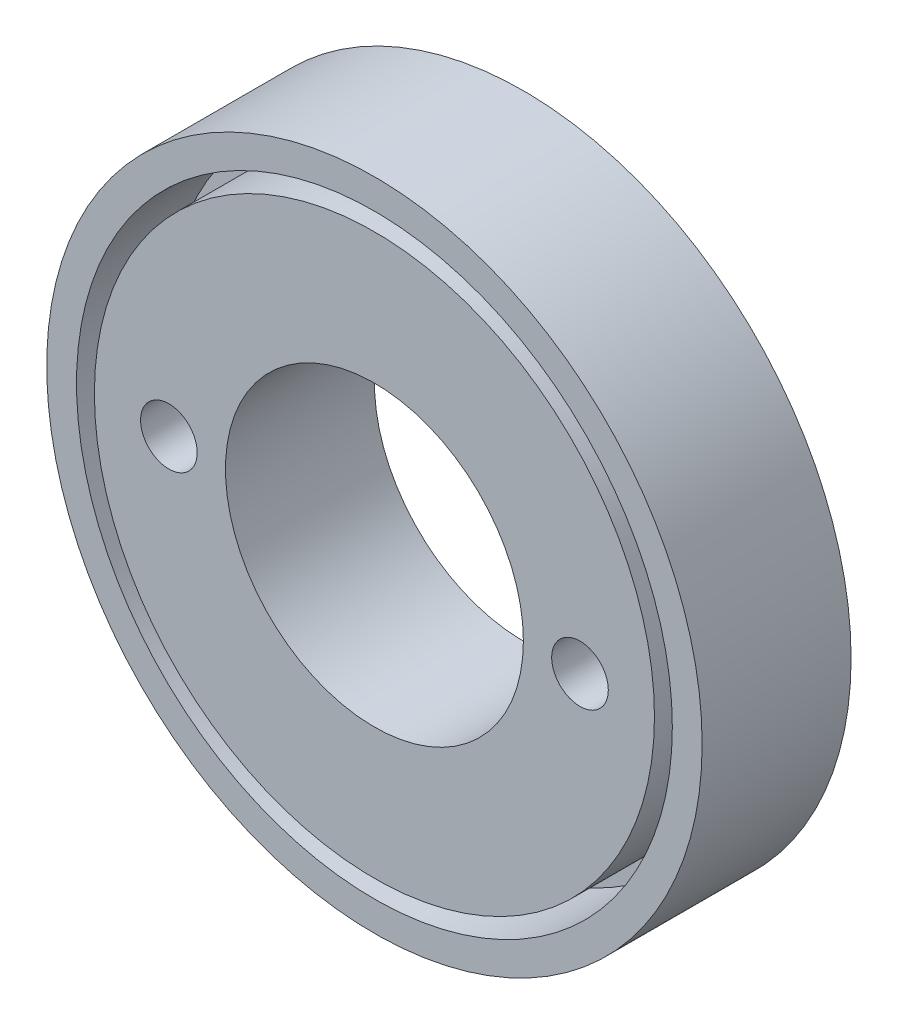
from build123d import *

# Parameters (mm, degrees)
BOSS_EXTRUDE1_DEPTH      = 10
BOSS_EXTRUDE1_DEPTH_BACK = 15
SKETCH1_R                = 55
SKETCH1_R_2              = 25
SKETCH2_R                = 50
SKETCH2_R_2              = 47
SKETCH2_R_3              = 4.75
CUT_EXTRUDE1_DEPTH       = 15


with BuildPart() as part:
    # Sketch1 → Boss-Extrude1 (new, two sides: drawn at the far end of the back side and taken through both)
    with BuildSketch(Plane.XY.offset(-BOSS_EXTRUDE1_DEPTH_BACK)):
        Circle(SKETCH1_R)
        Circle(SKETCH1_R_2, mode=Mode.SUBTRACT)
    extrude(amount=BOSS_EXTRUDE1_DEPTH + BOSS_EXTRUDE1_DEPTH_BACK)

    # Sketch2 → Cut-Extrude1 (cut)
    # profile 1 of 3: a face of its own
    with BuildSketch(Plane.XY.offset(10)):
        Circle(SKETCH2_R)
        Circle(SKETCH2_R_2, mode=Mode.SUBTRACT)
    # profile 2 of 3: a face of its own
    with BuildSketch(Plane.XY.offset(10)):
        with Locations((-34.5, 0)):
            Circle(SKETCH2_R_3)
    # profile 3 of 3: a face of its own
    with BuildSketch(Plane.XY.offset(10)):
        with Locations((34.5, 0)):
            Circle(SKETCH2_R_3)
    extrude(amount=-CUT_EXTRUDE1_DEPTH, mode=Mode.SUBTRACT)


solid = part.part
